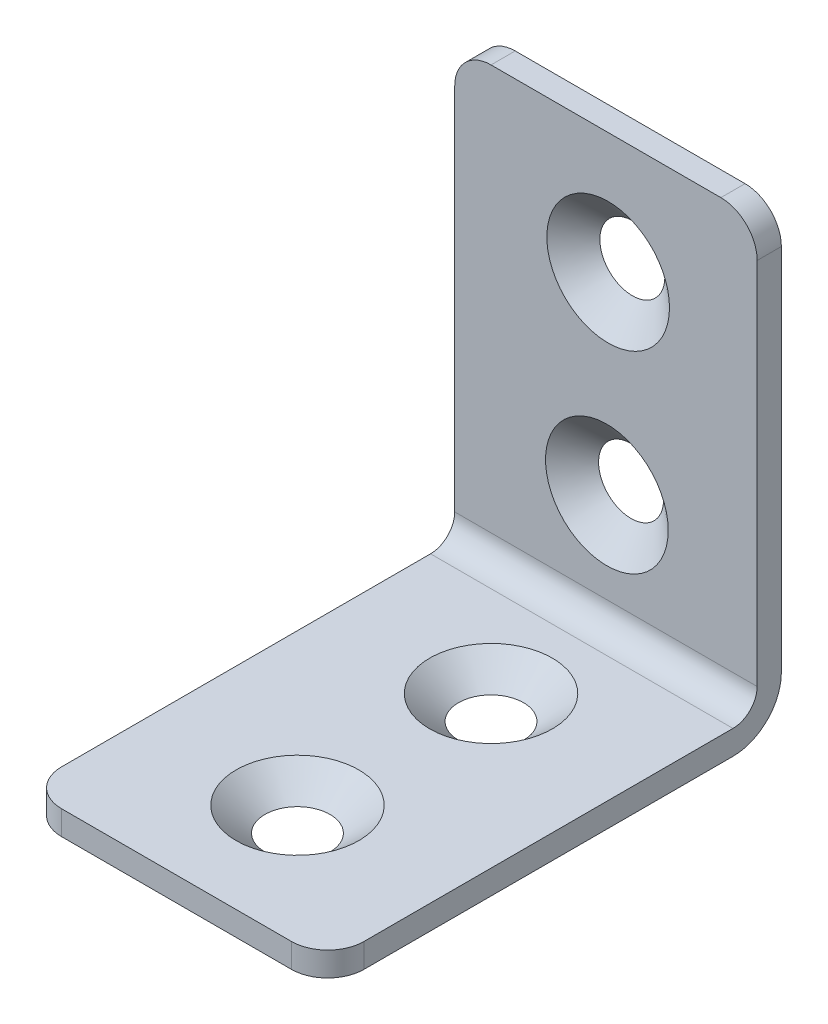
from build123d import *

# Parameters (mm, degrees)
SKETCH1_W                                      = 31.75
SKETCH1_H                                      = 47.625
BOSS_EXTRUDE1_DEPTH                            = 2.54
SKETCH3_W                                      = 31.75
SKETCH3_H                                      = 45.085
BOSS_EXTRUDE2_DEPTH                            = 2.54
FILLET1_R                                      = 5.08
FILLET2_R                                      = 2.54
FILLET3_R                                      = 3.81
CSK_FOR_1_4_FLAT_HEAD_MACHINE_SCREW_2_COUNT    = 2
CSK_FOR_1_4_FLAT_HEAD_MACHINE_SCREW_2_PITCH    = 20.320445496
CSK_FOR_1_4_FLAT_HEAD_MACHINE_SCREW_3_AT_COUNT = 2
CSK_FOR_1_4_FLAT_HEAD_MACHINE_SCREW_3_AT_PITCH = 20.32


with BuildPart() as part:
    # Sketch1 → Boss-Extrude1 (new body)
    with BuildSketch(Plane.XY):
        with Locations((15.875, 23.8125)):
            Rectangle(SKETCH1_W, SKETCH1_H)
    extrude(amount=BOSS_EXTRUDE1_DEPTH)

    # Sketch3 → Boss-Extrude2 (add)
    with BuildSketch(Plane.XZ):
        with Locations((15.875, 25.0825)):
            Rectangle(SKETCH3_W, SKETCH3_H)
    extrude(amount=-BOSS_EXTRUDE2_DEPTH)

    # Fillet1
    fillet1_edges = [part.edges().sort_by_distance(p)[0] for p in [
        (15.875, 0, 0),
    ]]
    fillet(fillet1_edges, radius=FILLET1_R)

    # Fillet2
    fillet2_edges = [part.edges().sort_by_distance(p)[0] for p in [
        (15.875, 2.54, 2.54),
    ]]
    fillet(fillet2_edges, radius=FILLET2_R)

    # Fillet3
    fillet3_edges = [part.edges().sort_by_distance(p)[0] for p in [
        (0, 1.27, 47.625),
        (31.75, 1.27, 47.625),
        (0, 47.625, 1.27),
        (31.75, 47.625, 1.27),
    ]]
    fillet(fillet3_edges, radius=FILLET3_R)

    # Sketch5 → CSK for 1_4 Flat Head Machine Screw _100 (revolve, cut)
    with BuildSketch(Plane(origin=(16.106267099, 34.925, 2.54), x_dir=(0, -1, 0), z_dir=(1, 0, 0))):
        Polygon((0, 0), (0, 2.54), (3.3782, 2.54), (3.3782, 2.568232241), (6.4389, 0), align=None)
    csk_for_1_4_flat_head_machine_screw_100 = revolve(axis=Axis((16.106267099, 34.925, 8.89), (0, 0, -1)), mode=Mode.SUBTRACT)

    # CSK for 1_4 Flat Head Machine Screw  2: CSK for 1_4 Flat Head Machine Screw _100 ×2
    with Locations(*[Vector(-0.006621675847692915, -0.9999780764641634, 0) * (i * CSK_FOR_1_4_FLAT_HEAD_MACHINE_SCREW_2_PITCH) for i in range(1, CSK_FOR_1_4_FLAT_HEAD_MACHINE_SCREW_2_COUNT)]):
        add(csk_for_1_4_flat_head_machine_screw_100, mode=Mode.SUBTRACT)

    # Sketch7 → CSK for 1_4 Flat Head Machine Screw  3 (revolve, cut)
    with BuildSketch(Plane(origin=(15.875, 2.54, 34.925), x_dir=(0, 0, 1), z_dir=(1, 0, 0))):
        Polygon((0, 0), (0, 2.54), (3.3782, 2.54), (3.3782, 2.568232241), (6.4389, 0), align=None)
    csk_for_1_4_flat_head_machine_screw_3 = revolve(axis=Axis((15.875, 8.89, 34.925), (0, -1, 0)), mode=Mode.SUBTRACT)

    # CSK for 1_4 Flat Head Machine Screw 3 at: CSK for 1_4 Flat Head Machine Screw  3 ×2
    with Locations(*[(0, 0, -i * CSK_FOR_1_4_FLAT_HEAD_MACHINE_SCREW_3_AT_PITCH) for i in range(1, CSK_FOR_1_4_FLAT_HEAD_MACHINE_SCREW_3_AT_COUNT)]):
        add(csk_for_1_4_flat_head_machine_screw_3, mode=Mode.SUBTRACT)


solid = part.part
